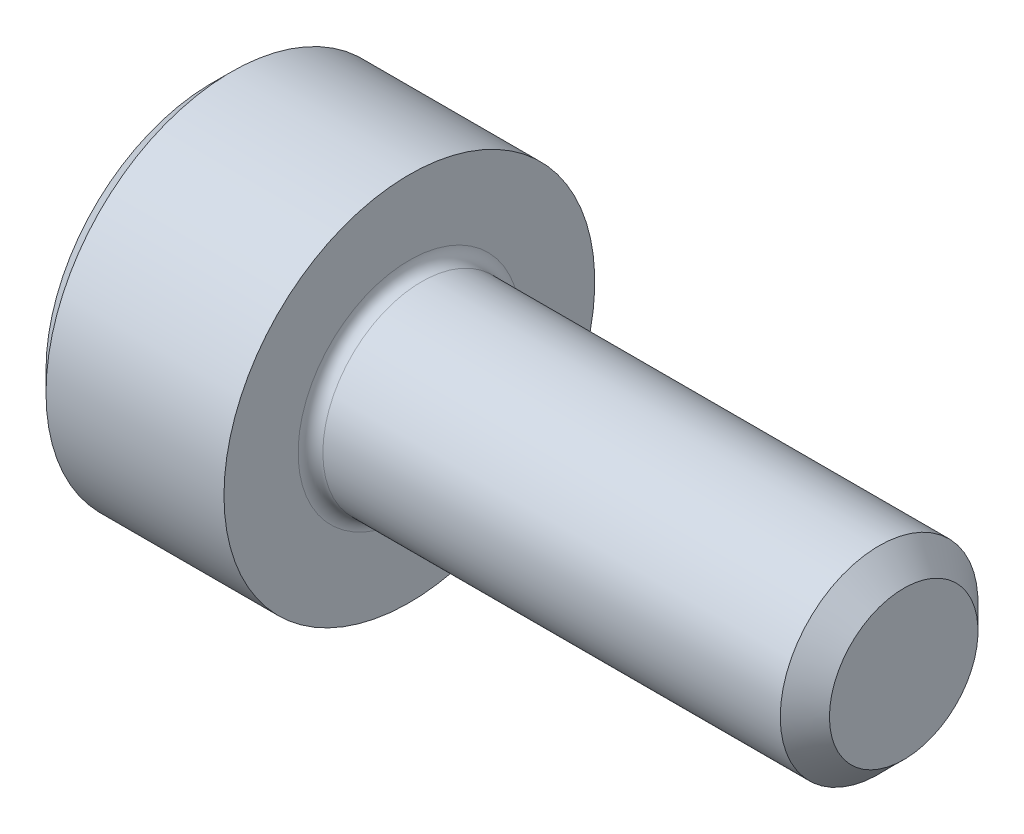
from build123d import *

# Parameters (mm, degrees)
FILLET1_R   = 0.1
HEX_2_DEPTH = 0.7


with BuildPart() as part:
    # BodySke → Base-Revolve (revolve)
    with BuildSketch(Plane.XY, mode=Mode.PRIVATE) as base_revolve_sk:
        Polygon((0, 0), (0, 1.34), (0.16, 1.5), (1.6, 1.5), (1.6, 0.8), (5.401, 0.8), (5.6, 0.601), (5.6, 0), align=None)
    revolve(base_revolve_sk.sketch.rotate(Axis((-31.75, 0, 0), (1, 0, 0)), 90), axis=Axis((-31.75, 0, 0), (1, 0, 0)))

    # Fillet1
    fillet1_edges = [part.edges().sort_by_distance(p)[0] for p in [
        (1.6, 0, -0.8),
    ]]
    fillet(fillet1_edges, radius=FILLET1_R)

    # Sketch2 → Hex-PreBroach (revolve, cut)
    with BuildSketch(Plane.XY, mode=Mode.PRIVATE) as hex_prebroach_sk:
        Polygon((0, 0.7725), (0.7, 0.7725), (1.146003083, 0), (0, 0), align=None)
    revolve(hex_prebroach_sk.sketch.rotate(Axis((0, 0, 0), (1, 0, 0)), 90), axis=Axis((0, 0, 0), (1, 0, 0)), mode=Mode.SUBTRACT)

    # Sketch3 → Hex 2 (cut)
    with BuildSketch(Plane(origin=(0, 0, 0), x_dir=(0, 0.500000000000001, 0.866025403784438), z_dir=(-1, 0, 0))):
        Polygon((0.446003083, 0.7725), (-0.446003083, 0.7725), (-0.892006166, 0), (-0.446003083, -0.7725), (0.446003083, -0.7725), (0.892006166, 0), align=None)
    extrude(amount=-HEX_2_DEPTH, mode=Mode.SUBTRACT)


solid = part.part
